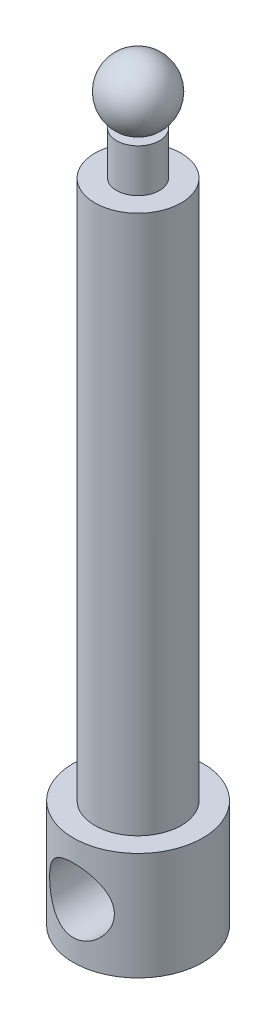
from build123d import *

# Parameters (mm, degrees)
SZKIC1_R                        = 2
DODANIE_WYCI_GNI_CIE1_DEPTH     = 25
SZKIC2_R                        = 1
DODANIE_WYCI_GNI_CIE2_DEPTH     = 2
SZKIC4_R                        = 3
DODANIE_WYCI_GNI_CIE3_DEPTH     = 5
WYTNIJ_WYCI_GNI_CIE1_DEPTH      = 31.272564199
WYTNIJ_WYCI_GNI_CIE1_DEPTH_BACK = 31.272564199
SZKIC5_R                        = 1.5


with BuildPart() as part:
    # Szkic1 → Dodanie-wyciągnięcie1 (new body)
    with BuildSketch(Plane(origin=(0, 0, 0), x_dir=(1, 0, 0), z_dir=(0, 1, 0))):
        with Locations(Location((0, 0, 0), (0, 0, 270))):
            Circle(SZKIC1_R)
    extrude(amount=DODANIE_WYCI_GNI_CIE1_DEPTH)

    # Szkic2 → Dodanie-wyciągnięcie2 (add)
    with BuildSketch(Plane(origin=(0, 25, 0), x_dir=(1, 0, 0), z_dir=(0, 1, 0))):
        with Locations(Location((0, 0, 0), (0, 0, 270))):
            Circle(SZKIC2_R)
    extrude(amount=DODANIE_WYCI_GNI_CIE2_DEPTH)

    # Szkic3 → Obrót3 (revolve)
    with BuildSketch(Plane.XY):
        with BuildLine():
            Line((0, 29.973790938), (0, 26.973790938))
            ThreePointArc((0, 26.973790938), (1.5, 28.473790938), (0, 29.973790938))
        make_face()
    revolve(axis=Axis((0, 0, 0), (0, 1, 0)))

    # Szkic4 → Dodanie-wyciągnięcie3 (add)
    with BuildSketch(Plane.XZ):
        with Locations(Location((0, 0, 0), (0, 0, 270))):
            Circle(SZKIC4_R)
    extrude(amount=DODANIE_WYCI_GNI_CIE3_DEPTH)

    # Szkic5 → Wytnij-wyciągnięcie1 (cut, two sides: drawn at the far end of the back side and taken through both)
    with BuildSketch(Plane.XY.offset(-WYTNIJ_WYCI_GNI_CIE1_DEPTH_BACK)):
        with Locations(Location((0, -2.5, 0), (0, 0, 270.000000001))):
            Circle(SZKIC5_R)
    extrude(amount=WYTNIJ_WYCI_GNI_CIE1_DEPTH + WYTNIJ_WYCI_GNI_CIE1_DEPTH_BACK, mode=Mode.SUBTRACT)


solid = part.part
